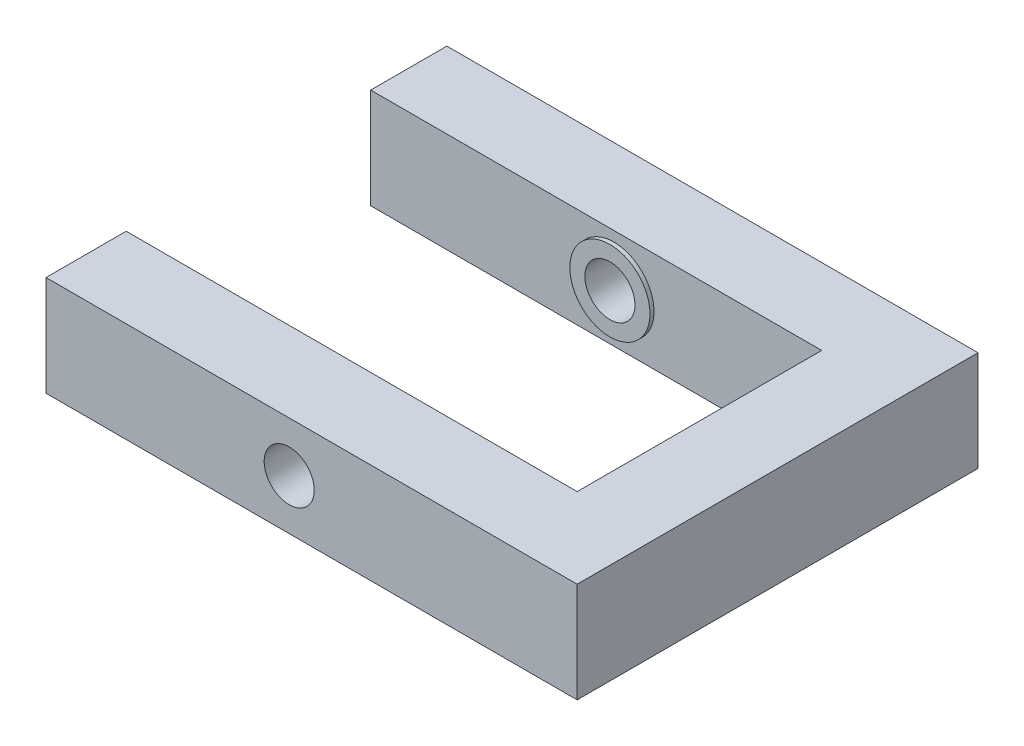
from build123d import *

# Parameters (mm, degrees)
BOSS_EXTRUDE1_DEPTH = 10
SKETCH2_R           = 2.5
CUT_EXTRUDE1_DEPTH  = 59
BOSS_EXTRUDE2_START = 0.4
SKETCH3_R           = 4
SKETCH3_R_2         = 2.5
BOSS_EXTRUDE2_DEPTH = 0.4


with BuildPart() as part:
    # Sketch1 → Boss-Extrude1 (new body)
    with BuildSketch(Plane(origin=(0, 0, 0), x_dir=(1, 0, 0), z_dir=(0, 1, 0))):
        Polygon((0, -12), (0, -20), (53, -20), (53, 20), (0, 20), (0, 12.4), (45, 12.4), (45, 12), (45, -12), align=None)
    extrude(amount=BOSS_EXTRUDE1_DEPTH)

    # Sketch2 → Cut-Extrude1 (cut)
    with BuildSketch(Plane.XY.offset(20)):
        with Locations((24.27, 5)):
            Circle(SKETCH2_R)
    extrude(amount=-CUT_EXTRUDE1_DEPTH, mode=Mode.SUBTRACT)

    # Sketch3 → Boss-Extrude2 (add)
    with BuildSketch(Plane.XY.offset(-12.4).offset(BOSS_EXTRUDE2_START)):
        with Locations(Location((24.27, 5, 0), (0, 0, 180))):
            Circle(SKETCH3_R)
        with Locations((24.27, 5)):
            Circle(SKETCH3_R_2, mode=Mode.SUBTRACT)
    extrude(amount=-BOSS_EXTRUDE2_DEPTH)


solid = part.part
